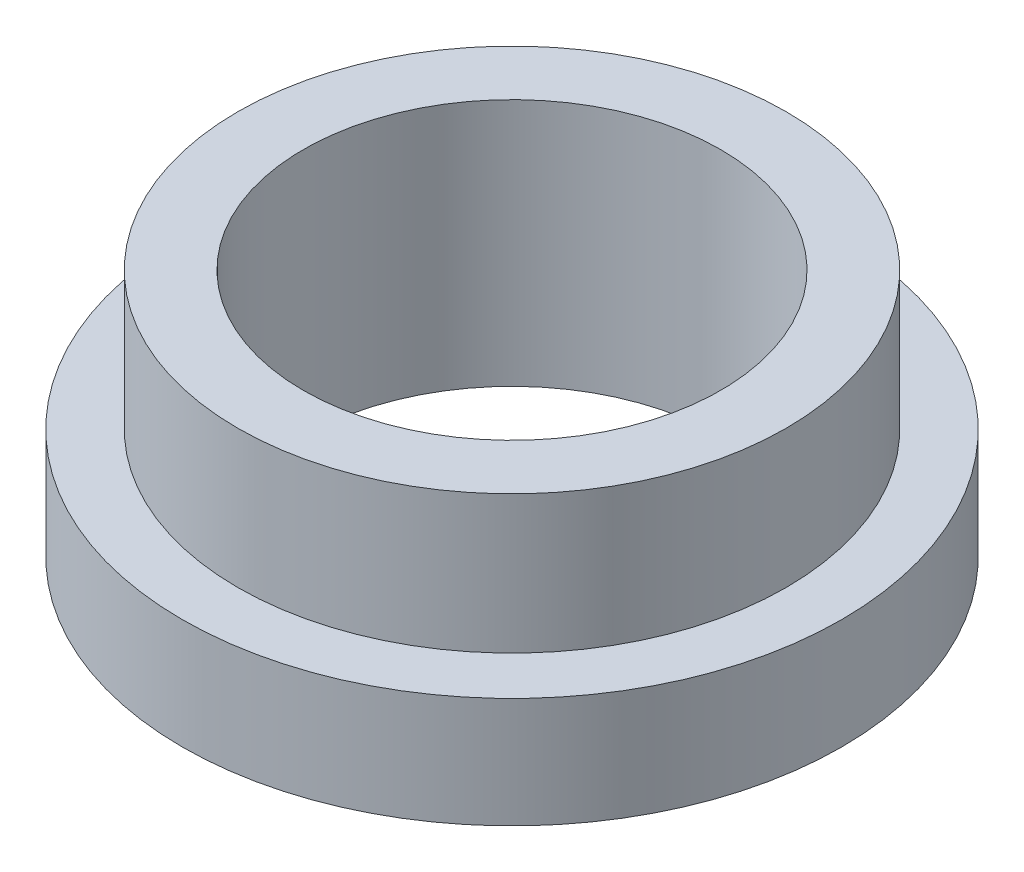
from build123d import *


with BuildPart() as part:
    # Sketch1 → Revolve1 (revolve)
    with BuildSketch(Plane.XY, mode=Mode.PRIVATE) as revolve1_sk:
        Polygon((-3.025, 0), (-3.025, 3.6), (-3.975, 3.6), (-3.975, 1.6), (-4.78, 1.6), (-4.78, 0), align=None)
    revolve(revolve1_sk.sketch.rotate(Axis((0, 0, 0), (0, 1, 0)), 270), axis=Axis((0, 0, 0), (0, 1, 0)))


solid = part.part
